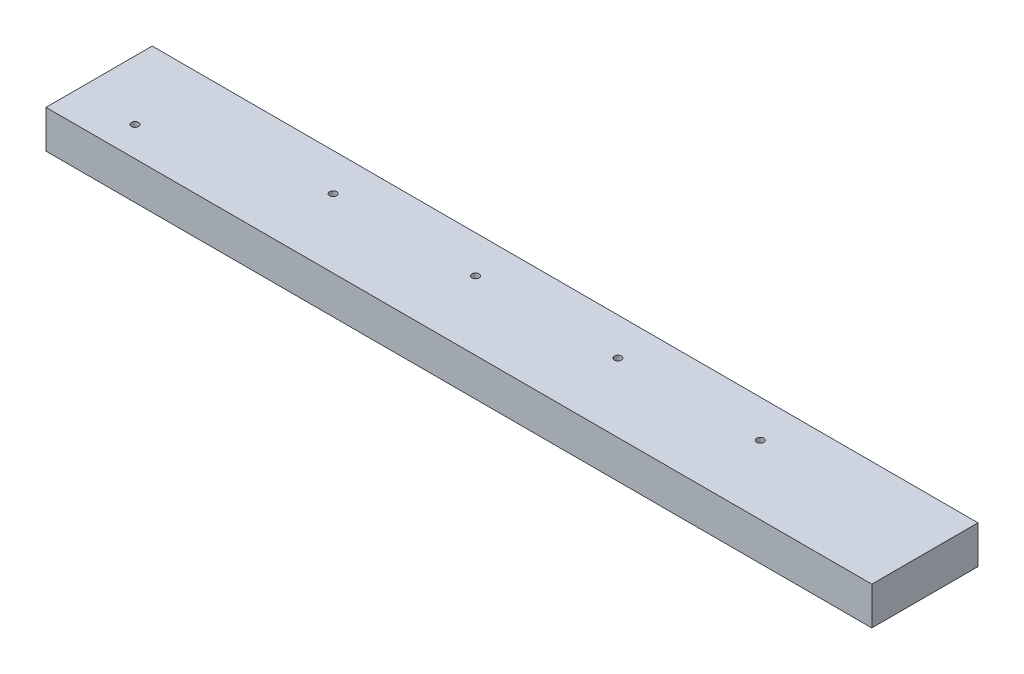
from build123d import *

# Parameters (mm, degrees)
SKETCH1_W           = 2209.8
SKETCH1_H           = 284.1625
BOSS_EXTRUDE1_DEPTH = 50.8
SKETCH2_R           = 9.525
CUT_EXTRUDE1_DEPTH  = 1119.621317337
SKETCH3_W           = 85.725
SKETCH3_H           = 44.45
CUT_EXTRUDE2_DEPTH  = 25.4


with BuildPart() as part:
    # Sketch1 → Boss-Extrude1 (new, symmetric)
    with BuildSketch(Plane(origin=(0, 0, 0), x_dir=(1, 0, 0), z_dir=(0, 1, 0))):
        Rectangle(SKETCH1_W, SKETCH1_H)
    extrude(amount=BOSS_EXTRUDE1_DEPTH, both=True)

    # Sketch2 → Cut-Extrude1 (cut, through all)
    with BuildSketch(Plane(origin=(0, 50.8, 0), x_dir=(1, 0, 0), z_dir=(0, 1, 0))):
        with Locations(Location((-946.15, -62.70625, 0), (0, 0, 270))):
            Circle(SKETCH2_R)
        with Locations(Location((-520.7, 42.06875, 0), (0, 0, 270))):
            Circle(SKETCH2_R)
        with Locations(Location((-139.7, 42.06875, 0), (0, 0, 270))):
            Circle(SKETCH2_R)
        with Locations(Location((241.3, 42.06875, 0), (0, 0, 270))):
            Circle(SKETCH2_R)
        with Locations(Location((622.3, 42.06875, 0), (0, 0, 270))):
            Circle(SKETCH2_R)
    extrude(amount=-CUT_EXTRUDE1_DEPTH, mode=Mode.SUBTRACT)

    # Sketch3 → Cut-Extrude2 (cut)
    with BuildSketch(Plane.XZ.offset(50.8)):
        with Locations((531.8125, -91.28125)):
            Rectangle(SKETCH3_W, SKETCH3_H)
        with Locations((-661.9875, -91.28125)):
            Rectangle(SKETCH3_W, SKETCH3_H)
    extrude(amount=-CUT_EXTRUDE2_DEPTH, mode=Mode.SUBTRACT)


solid = part.part
